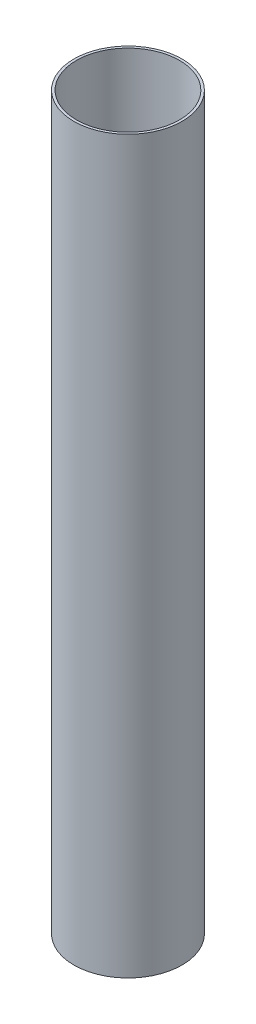
from build123d import *

# Parameters (mm, degrees)
BOSS_EXTRUDE1_DEPTH      = 351
BOSS_EXTRUDE1_DEPTH_BACK = 351
SKETCH1_R                = 51.95
SKETCH1_R_2              = 49.55


with BuildPart() as part:
    # Sketch1 → Boss-Extrude1 (new, two sides: drawn at the far end of the back side and taken through both)
    with BuildSketch(Plane(origin=(0, 0, 0), x_dir=(1, 0, 0), z_dir=(0, 1, 0)).offset(-BOSS_EXTRUDE1_DEPTH_BACK)):
        Circle(SKETCH1_R)
        Circle(SKETCH1_R_2, mode=Mode.SUBTRACT)
    extrude(amount=BOSS_EXTRUDE1_DEPTH + BOSS_EXTRUDE1_DEPTH_BACK)


solid = part.part
